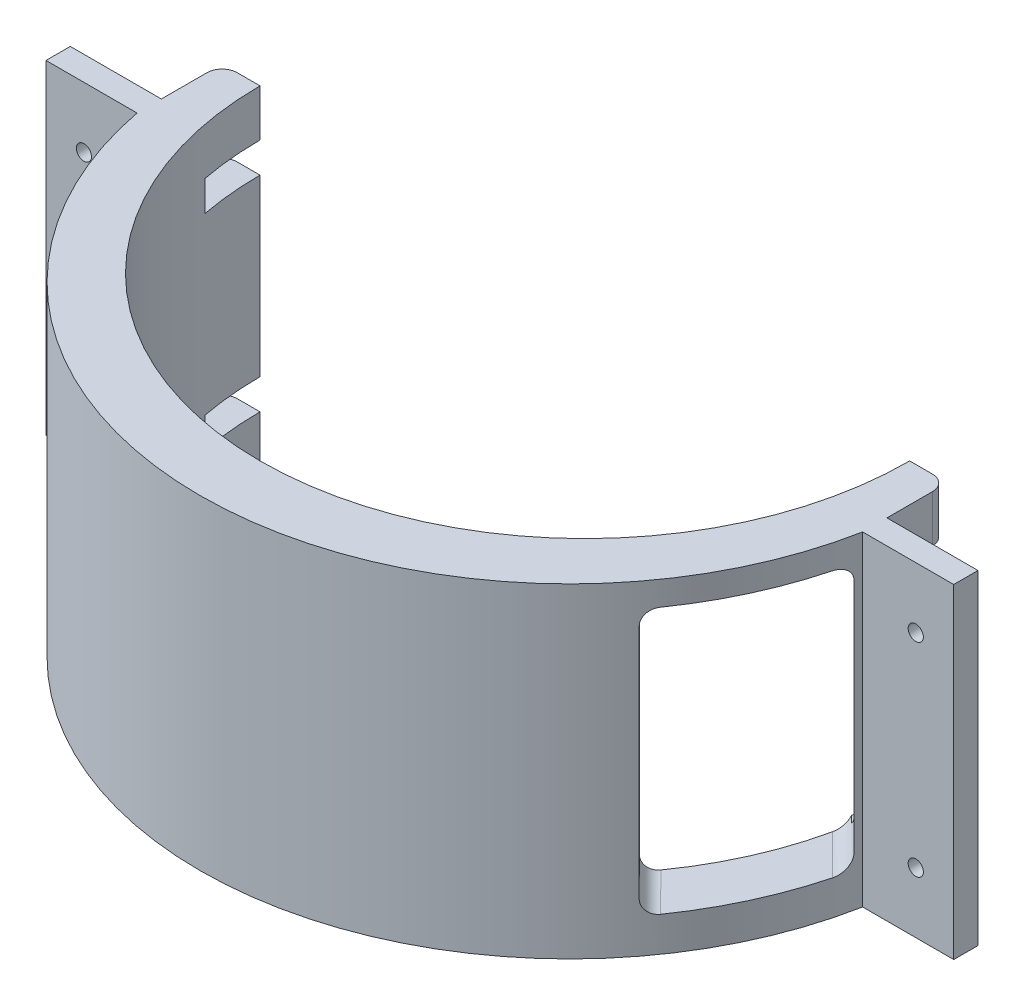
from build123d import *

# Parameters (mm, degrees)
BOSS_EXTRUDE1_DEPTH     = 107
SKETCH2_R               = 2.5
CUT_EXTRUDE1_DEPTH      = 336.0337743
CUT_EXTRUDE4_REACH      = 337.034
SKETCH5_W               = 15.542799326
SKETCH5_H               = 10
SKETCH5_W_2             = 18.63674205
CUT_EXTRUDE5_DEPTH      = 255.70554643
CUT_EXTRUDE5_DEPTH_BACK = 255.70554643


with BuildPart() as part:
    # Sketch1 → Boss-Extrude1 (new body)
    with BuildSketch(Plane(origin=(0, 0, 0), x_dir=(1, 0, 0), z_dir=(0, 1, 0))):
        with BuildLine():
            Line((0, 0), (0, -8))
            Line((0, -8), (30, -8))
            ThreePointArc((30, -8), (149.5, -106.759683035), (269, -8))
            Line((269, -8), (299, -8))
            Line((299, -8), (299, 0))
            Line((299, 0), (269, 0))
            Line((269, 0), (269, 15))
            ThreePointArc((269, 15), (267.535533906, 18.535533906), (264, 20))
            Line((264, 20), (256.5, 20))
            ThreePointArc((256.5, 20), (149.5, -87.000008561), (42.5, 20))
            Line((42.5, 20), (35, 20))
            ThreePointArc((35, 20), (31.464466094, 18.535533906), (30, 15))
            Line((30, 15), (30, 0))
            Line((30, 0), (0, 0))
        make_face()
    extrude(amount=BOSS_EXTRUDE1_DEPTH)

    # Sketch2 → Cut-Extrude1 (cut, through all)
    with BuildSketch(Plane(origin=(0, 0, 0), x_dir=(-1, 0, 0), z_dir=(0, 0, -1))):
        with Locations((-286.5, 87)):
            Circle(SKETCH2_R)
        with Locations((-286.5, 20)):
            Circle(SKETCH2_R)
        with Locations((-12.5, 87)):
            Circle(SKETCH2_R)
        with Locations((-12.5, 20)):
            Circle(SKETCH2_R)
    extrude(amount=-CUT_EXTRUDE1_DEPTH, mode=Mode.SUBTRACT)

    # Cut-Extrude4: up to this face of the body (flat: up to its plane)
    cut_extrude4_end = Plane(part.part.faces().sort_by_distance((260.25, 53.5, -20))[0])
    # Sketch5 → Cut-Extrude4 (cut, up to the picked face)
    with BuildSketch(Plane(origin=(0, 0, 0), x_dir=(-1, 0, 0), z_dir=(0, 0, -1)), mode=Mode.PRIVATE) as cut_extrude4_sk1:
        with Locations((-261.228600337, 86.535453814)):
            Rectangle(SKETCH5_W, SKETCH5_H)
    cut_extrude4_tool1 = split(extrude(cut_extrude4_sk1.sketch, amount=CUT_EXTRUDE4_REACH, mode=Mode.PRIVATE), bisect_by=cut_extrude4_end, keep=Keep.BOTH, mode=Mode.PRIVATE)
    # Sketch5 → Cut-Extrude4 (cut, up to the picked face)
    with BuildSketch(Plane(origin=(0, 0, 0), x_dir=(-1, 0, 0), z_dir=(0, 0, -1)), mode=Mode.PRIVATE) as cut_extrude4_sk2:
        with Locations((-259.681628975, 19.008712967)):
            Rectangle(SKETCH5_W_2, SKETCH5_H)
    cut_extrude4_tool2 = split(extrude(cut_extrude4_sk2.sketch, amount=CUT_EXTRUDE4_REACH, mode=Mode.PRIVATE), bisect_by=cut_extrude4_end, keep=Keep.BOTH, mode=Mode.PRIVATE)
    # Sketch5 → Cut-Extrude4 (cut, up to the picked face)
    with BuildSketch(Plane(origin=(0, 0, 0), x_dir=(-1, 0, 0), z_dir=(0, 0, -1)), mode=Mode.PRIVATE) as cut_extrude4_sk3:
        with Locations((-39.318371025, 19.008712967)):
            Rectangle(SKETCH5_W_2, SKETCH5_H)
    cut_extrude4_tool3 = split(extrude(cut_extrude4_sk3.sketch, amount=CUT_EXTRUDE4_REACH, mode=Mode.PRIVATE), bisect_by=cut_extrude4_end, keep=Keep.BOTH, mode=Mode.PRIVATE)
    # Sketch5 → Cut-Extrude4 (cut, up to the picked face)
    with BuildSketch(Plane(origin=(0, 0, 0), x_dir=(-1, 0, 0), z_dir=(0, 0, -1)), mode=Mode.PRIVATE) as cut_extrude4_sk4:
        with Locations((-37.771399663, 86.535453814)):
            Rectangle(SKETCH5_W, SKETCH5_H)
    cut_extrude4_tool4 = split(extrude(cut_extrude4_sk4.sketch, amount=CUT_EXTRUDE4_REACH, mode=Mode.PRIVATE), bisect_by=cut_extrude4_end, keep=Keep.BOTH, mode=Mode.PRIVATE)
    add(cut_extrude4_tool1.solids().sort_by(Axis((261.2286, 86.535454, 0), (0, 0, -1)))[0], mode=Mode.SUBTRACT)
    add(cut_extrude4_tool2.solids().sort_by(Axis((259.681629, 19.008713, 0), (0, 0, -1)))[0], mode=Mode.SUBTRACT)
    add(cut_extrude4_tool3.solids().sort_by(Axis((39.318371, 19.008713, 0), (0, 0, -1)))[0], mode=Mode.SUBTRACT)
    add(cut_extrude4_tool4.solids().sort_by(Axis((37.7714, 86.535454, 0), (0, 0, -1)))[0], mode=Mode.SUBTRACT)

    # Sketch8 → Cut-Extrude5 (cut, two sides: drawn at the far end of the back side and taken through both)
    with BuildSketch(Plane(origin=(152.698962186, 0, 153.519285181), x_dir=(0.7089984938103423, 0, -0.7052099940972661), z_dir=(0.7052099940972661, 0, 0.7089984938103423)).offset(-CUT_EXTRUDE5_DEPTH_BACK)):
        with BuildLine():
            Line((138.078914882, 99.021927615), (178.078914882, 99.021927615))
            ThreePointArc((178.078914882, 99.021927615), (181.614448788, 97.557461521), (183.078914882, 94.021927615))
            Line((183.078914882, 94.021927615), (183.078914882, 16.437469362))
            ThreePointArc((183.078914882, 16.437469362), (181.614448788, 12.901935456), (178.078914882, 11.437469362))
            Line((178.078914882, 11.437469362), (138.078914882, 11.437469362))
            ThreePointArc((138.078914882, 11.437469362), (134.543380976, 12.901935456), (133.078914882, 16.437469362))
            Line((133.078914882, 16.437469362), (133.078914882, 94.021927615))
            ThreePointArc((133.078914882, 94.021927615), (134.543380976, 97.557461521), (138.078914882, 99.021927615))
        make_face()
    extrude(amount=CUT_EXTRUDE5_DEPTH + CUT_EXTRUDE5_DEPTH_BACK, mode=Mode.SUBTRACT)


solid = part.part
